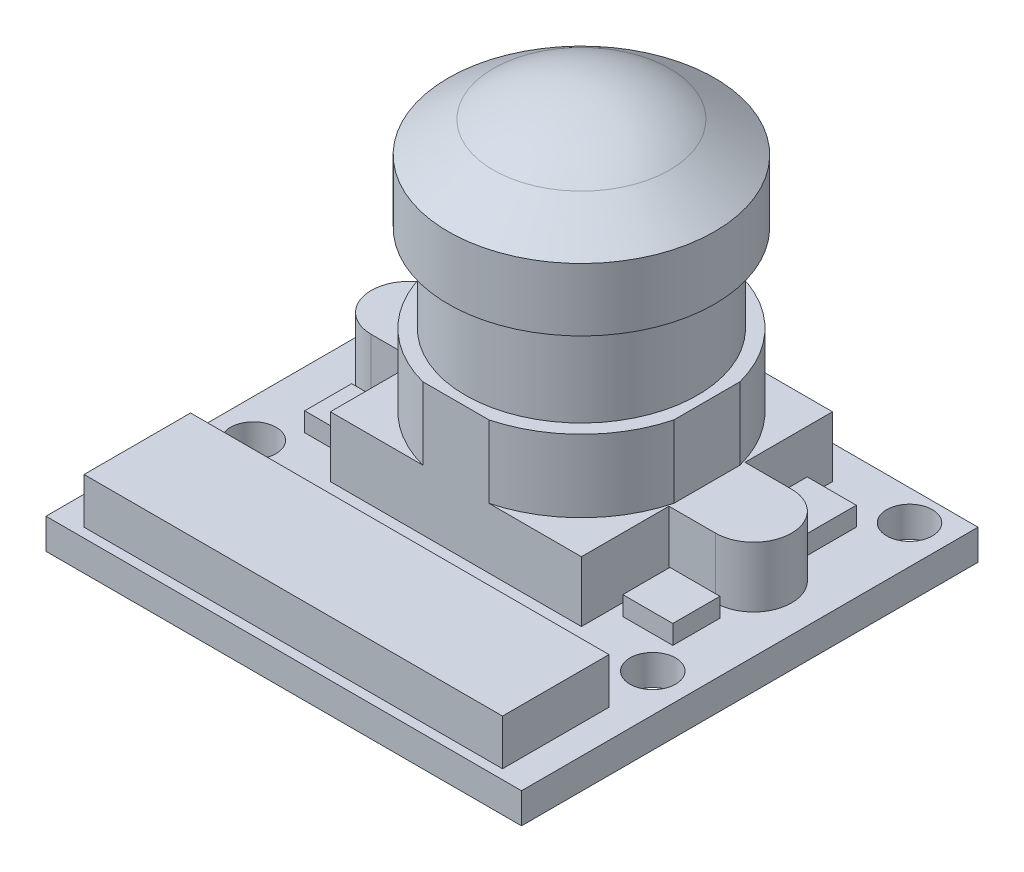
from build123d import *

# Parameters (mm, degrees)
ESQUISSE1_W        = 25
ESQUISSE1_H        = 24
BOSS_EXTRU_1_DEPTH = 1.6
BOSS_EXTRU_2_DEPTH = 3.18
BOSS_EXTRU_3_DEPTH = 3.8
ESQUISSE6_R        = 6.1
BOSS_EXTRU_4_DEPTH = 4.6
D_GAGEMENT_M21_D   = 2.4
ESQUISSE11_W       = 22
ESQUISSE11_H       = 5.6
BOSS_EXTRU_6_DEPTH = 2.4
ESQUISSE12_R       = 1.56
BOSS_EXTRU_7_DEPTH = 1.1
ESQUISSE13_W       = 2.577210691
ESQUISSE13_H       = 3.020616424
ESQUISSE13_W_2     = 2.628074632
ESQUISSE13_H_2     = 2.477608005
ESQUISSE13_W_3     = 2.260050421
ESQUISSE13_H_3     = 2.470679231
ESQUISSE13_W_4     = 2.751019587
ESQUISSE13_H_4     = 2.314618906
BOSS_EXTRU_8_DEPTH = 1


with BuildPart() as part:
    # Esquisse1 → Boss.-Extru.1 (new body)
    with BuildSketch(Plane(origin=(0, 0, 0), x_dir=(1, 0, 0), z_dir=(0, 1, 0))):
        Rectangle(ESQUISSE1_W, ESQUISSE1_H)
    extrude(amount=BOSS_EXTRU_1_DEPTH)

    # Esquisse4 → Boss.-Extru.2 (add)
    with BuildSketch(Plane(origin=(0, 1.6, 0), x_dir=(1, 0, 0), z_dir=(0, 1, 0))):
        with BuildLine():
            Line((6.6, 10.25), (6.6, 5.65))
            Line((6.6, 5.65), (9.05, 5.65))
            ThreePointArc((9.05, 5.65), (11.05, 3.65), (9.05, 1.65))
            Line((9.05, 1.65), (6.6, 1.65))
            Line((6.6, 1.65), (6.6, -2.95))
            Line((6.6, -2.95), (-6.6, -2.95))
            Line((-6.6, -2.95), (-6.6, 1.65))
            Line((-6.6, 1.65), (-9.05, 1.65))
            ThreePointArc((-9.05, 1.65), (-11.05, 3.65), (-9.05, 5.65))
            Line((-9.05, 5.65), (-6.6, 5.65))
            Line((-6.6, 5.65), (-6.6, 10.25))
            Line((-6.6, 10.25), (6.6, 10.25))
        make_face()
    extrude(amount=BOSS_EXTRU_2_DEPTH)

    # Esquisse5 → Boss.-Extru.3 (add)
    with BuildSketch(Plane(origin=(0, 4.78, 0), x_dir=(1, 0, 0), z_dir=(0, 1, 0))):
        with BuildLine():
            Line((-6.6, 1.912005466), (-6.6, 5.387994534))
            ThreePointArc((-6.6, 5.387994534), (-4.826003782, 8.476003782), (-1.737994534, 10.25))
            Line((-1.737994534, 10.25), (1.737994534, 10.25))
            ThreePointArc((1.737994534, 10.25), (4.826003782, 8.476003782), (6.6, 5.387994534))
            Line((6.6, 5.387994534), (6.6, 1.912005466))
            ThreePointArc((6.6, 1.912005466), (4.826003782, -1.176003782), (1.737994534, -2.95))
            Line((1.737994534, -2.95), (-1.737994534, -2.95))
            ThreePointArc((-1.737994534, -2.95), (-4.826003782, -1.176003782), (-6.6, 1.912005466))
        make_face()
    extrude(amount=BOSS_EXTRU_3_DEPTH)

    # Esquisse6 → Boss.-Extru.4 (add)
    with BuildSketch(Plane(origin=(0, 8.58, 0), x_dir=(1, 0, 0), z_dir=(0, 1, 0))):
        with Locations((0, 3.65)):
            Circle(ESQUISSE6_R)
    extrude(amount=BOSS_EXTRU_4_DEPTH)

    # Esquisse8 → Révolution1 (revolve)
    with BuildSketch(Plane.XY.offset(-3.65)):
        with BuildLine():
            Line((0, 13.18), (-7, 13.18))
            Line((-7, 13.18), (-7, 16.48))
            Line((-7, 16.48), (-4.631719117, 18.098501714))
            ThreePointArc((-4.631719117, 18.098501714), (-2.423943549, 19.163964644), (0, 19.53))
            Line((0, 19.53), (0, 13.18))
        make_face()
    revolve(axis=Axis((0, 13.18, -3.65), (0, 1, 0)))

    # Dégagement M21 (through all)
    with Locations(Plane(origin=(0, 1.6, 0), x_dir=(1, 0, 0), z_dir=(0, 1, 0))):
        with Locations((-10.5, 10.4), (10.5, 10.4), (10.5, -3.1), (-10.5, -3.1)):
            Hole(D_GAGEMENT_M21_D / 2)

    # Esquisse11 → Boss.-Extru.6 (add)
    with BuildSketch(Plane(origin=(0, 1.6, 0), x_dir=(1, 0, 0), z_dir=(0, 1, 0))):
        with Locations((0, -8.7)):
            Rectangle(ESQUISSE11_W, ESQUISSE11_H)
    extrude(amount=BOSS_EXTRU_6_DEPTH)

    # Esquisse12 → Boss.-Extru.7 (add)
    with BuildSketch(Plane.XZ):
        with Locations((-9.05, -3.65)):
            Circle(ESQUISSE12_R)
        with Locations((9.05, -3.65)):
            Circle(ESQUISSE12_R)
    extrude(amount=BOSS_EXTRU_7_DEPTH)

    # Esquisse13 → Boss.-Extru.8 (add)
    with BuildSketch(Plane(origin=(0, 1.6, 0), x_dir=(1, 0, 0), z_dir=(0, 1, 0))):
        with Locations((8.011394655, 7.289691788)):
            Rectangle(ESQUISSE13_W, ESQUISSE13_H)
        with Locations((8.546867327, -0.168124771)):
            Rectangle(ESQUISSE13_W_2, ESQUISSE13_H_2)
        with Locations((-8.36997479, -0.164660384)):
            Rectangle(ESQUISSE13_W_3, ESQUISSE13_H_3)
        with Locations((-8.324490207, 7.042690547)):
            Rectangle(ESQUISSE13_W_4, ESQUISSE13_H_4)
    extrude(amount=BOSS_EXTRU_8_DEPTH)


solid = part.part
